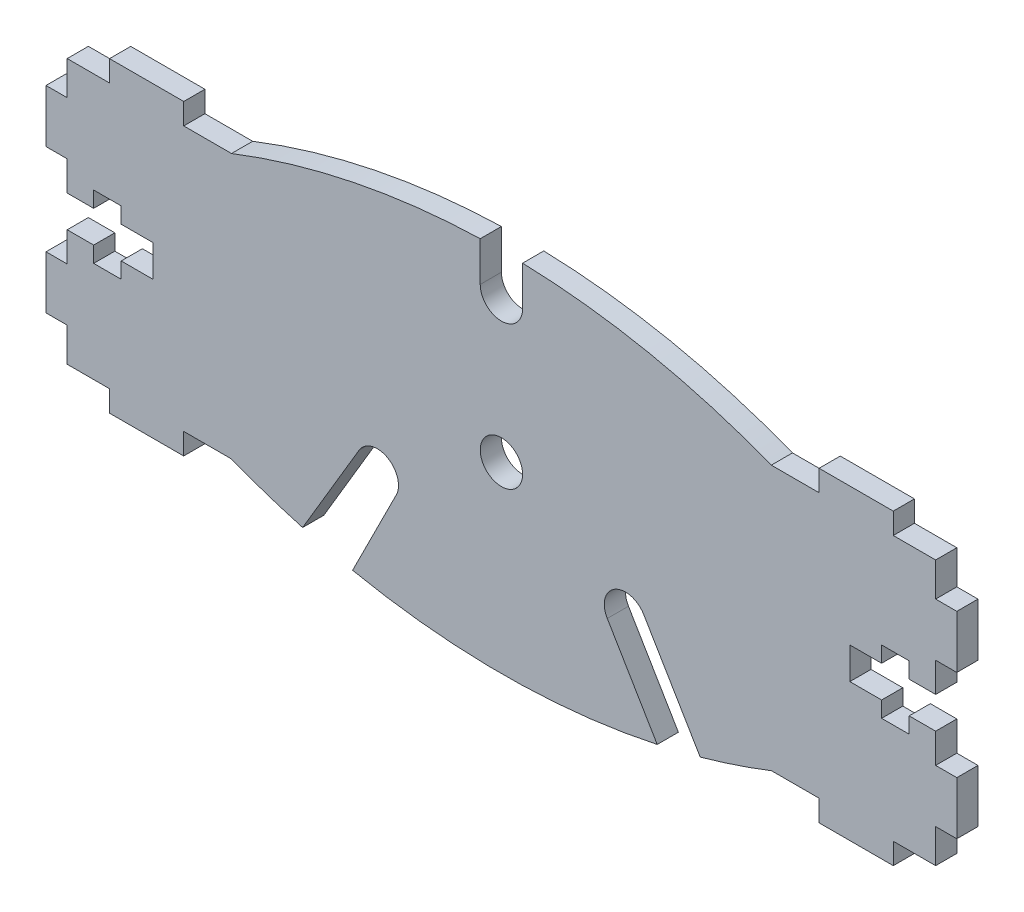
from build123d import *

# Parameters (mm, degrees)
SKETCH_1_R      = 2
EXTRUDE_2_DEPTH = 2


with BuildPart() as part:
    # 草图1 → 凸台-拉伸2 (new body)
    with BuildSketch(Plane.XY):
        with BuildLine():
            Line((-29.994433528, 12.494433528), (-25.48340173, 12.494433528))
            ThreePointArc((-25.48340173, 12.494433528), (-13.947547573, 15.894235428), (-2, 17.269259451))
            Line((-2, 17.269259451), (-2, 13.53))
            ThreePointArc((-2, 13.53), (0, 11.53), (2, 13.53))
            Line((2, 13.53), (2, 17.269259451))
            ThreePointArc((2, 17.269259451), (13.947547573, 15.894235428), (25.48340173, 12.494433528))
            Line((25.48340173, 12.494433528), (29.994433528, 12.494433528))
            Line((29.994433528, 12.494433528), (29.994433528, 14.494433528))
            Line((29.994433528, 14.494433528), (37, 14.494433528))
            Line((37, 14.494433528), (37, 12.5))
            Line((37, 12.5), (41, 12.5))
            Line((41, 12.5), (41, 9.3))
            Line((41, 9.3), (43, 9.3))
            Line((43, 9.3), (43, 4.3))
            Line((43, 4.3), (41, 4.3))
            Line((41, 4.3), (41, 1.5))
            Line((41, 1.5), (38.5, 1.5))
            Line((38.5, 1.5), (38.5, 3))
            Line((38.5, 3), (35.9, 3))
            Line((35.9, 3), (35.9, 1.5))
            Line((35.9, 1.5), (32.9, 1.5))
            Line((32.9, 1.5), (32.9, -1.5))
            Line((32.9, -1.5), (35.9, -1.5))
            Line((35.9, -1.5), (35.9, -3))
            Line((35.9, -3), (38.5, -3))
            Line((38.5, -3), (38.5, -1.5))
            Line((38.5, -1.5), (41, -1.5))
            Line((41, -1.5), (41, -4.3))
            Line((41, -4.3), (43, -4.3))
            Line((43, -4.3), (43, -9.3))
            Line((43, -9.3), (41, -9.3))
            Line((41, -9.3), (41, -12.5))
            Line((41, -12.5), (37, -12.5))
            Line((37, -12.5), (37, -14.5))
            Line((37, -14.5), (30, -14.5))
            Line((30, -14.5), (30, -12.485627756))
            Line((30, -12.485627756), (25.50333236, -12.485627756))
            ThreePointArc((25.50333236, -12.485627756), (22.164855453, -13.695011333), (18.769346851, -14.733547814))
            Line((18.769346851, -14.733547814), (13.437476273, -5.744669088))
            ThreePointArc((13.437476273, -5.744669088), (10.696992802, -5.04484744), (9.997171153, -7.785330912))
            Line((9.997171153, -7.785330912), (14.711679138, -15.733412155))
            ThreePointArc((14.711679138, -15.733412155), (0.337099689, -17.296013049), (-14.051862928, -15.871930634))
            Line((-14.051862928, -15.871930634), (-9.997171153, -7.785330912))
            ThreePointArc((-9.997171153, -7.785330912), (-10.696992802, -5.04484744), (-13.437476273, -5.744669088))
            Line((-13.437476273, -5.744669088), (-18.769346851, -14.733547814))
            ThreePointArc((-18.769346851, -14.733547814), (-22.164855453, -13.695011333), (-25.50333236, -12.485627756))
            Line((-25.50333236, -12.485627756), (-30, -12.485627756))
            Line((-30, -12.485627756), (-30, -14.5))
            Line((-30, -14.5), (-37, -14.5))
            Line((-37, -14.5), (-37, -12.5))
            Line((-37, -12.5), (-41, -12.5))
            Line((-41, -12.5), (-41, -9.3))
            Line((-41, -9.3), (-43, -9.3))
            Line((-43, -9.3), (-43, -4.3))
            Line((-43, -4.3), (-41, -4.3))
            Line((-41, -4.3), (-41, -1.5))
            Line((-41, -1.5), (-38.5, -1.5))
            Line((-38.5, -1.5), (-38.5, -3))
            Line((-38.5, -3), (-35.9, -3))
            Line((-35.9, -3), (-35.9, -1.5))
            Line((-35.9, -1.5), (-32.9, -1.5))
            Line((-32.9, -1.5), (-32.9, 1.5))
            Line((-32.9, 1.5), (-35.9, 1.5))
            Line((-35.9, 1.5), (-35.9, 3))
            Line((-35.9, 3), (-38.5, 3))
            Line((-38.5, 3), (-38.5, 1.5))
            Line((-38.5, 1.5), (-41, 1.5))
            Line((-41, 1.5), (-41, 4.3))
            Line((-41, 4.3), (-43, 4.3))
            Line((-43, 4.3), (-43, 9.3))
            Line((-43, 9.3), (-41, 9.3))
            Line((-41, 9.3), (-41, 12.5))
            Line((-41, 12.5), (-37, 12.5))
            Line((-37, 12.5), (-37, 14.494433528))
            Line((-37, 14.494433528), (-29.994433528, 14.494433528))
            Line((-29.994433528, 14.494433528), (-29.994433528, 12.494433528))
        make_face()
        Circle(SKETCH_1_R, mode=Mode.SUBTRACT)
    extrude(amount=EXTRUDE_2_DEPTH)


solid = part.part
